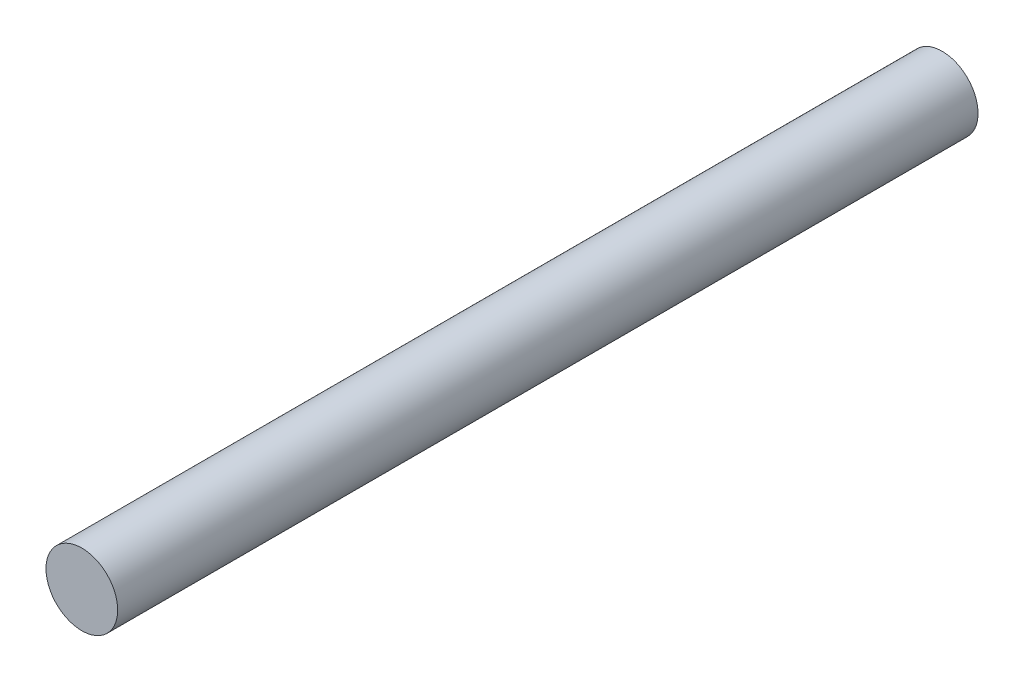
from build123d import *

# Parameters (mm, degrees)
SKETCH_1_R      = 1.75
EXTRUDE_1_DEPTH = 42


with BuildPart() as part:
    # 草图1 → 凸台-拉伸1 (new body)
    with BuildSketch(Plane.XY):
        with Locations(Location((0, 0, 0), (0, 0, 180))):
            Circle(SKETCH_1_R)
    extrude(amount=EXTRUDE_1_DEPTH)


solid = part.part
